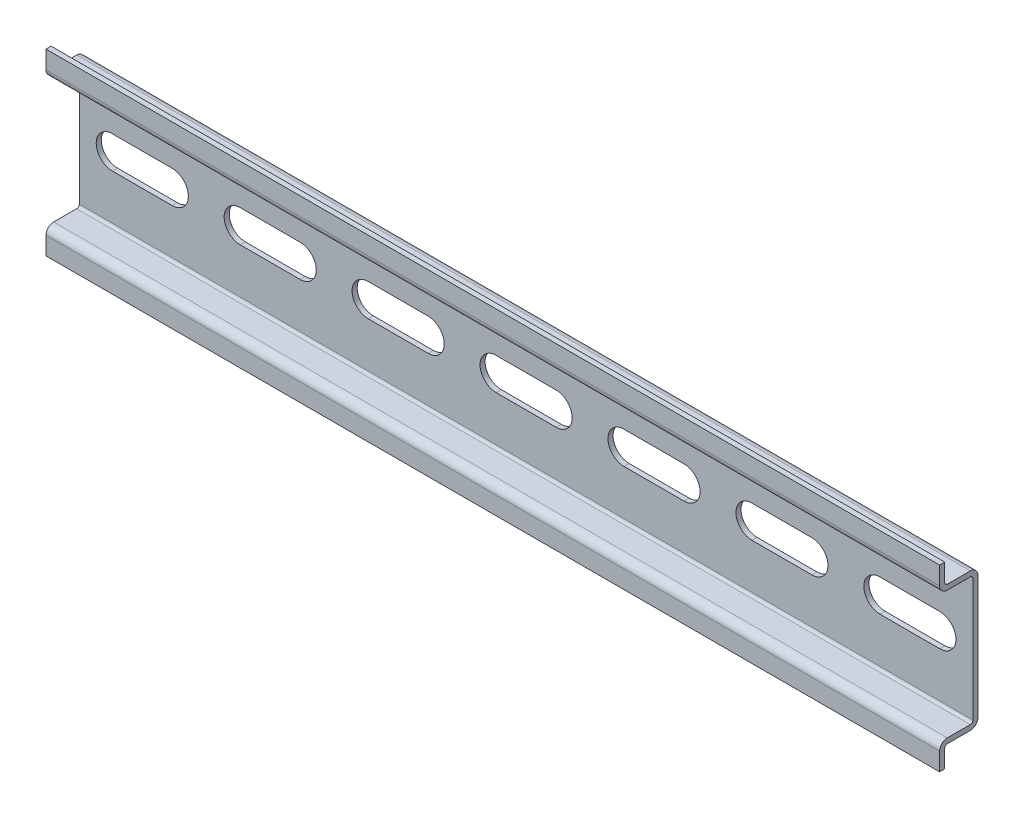
from build123d import *

# Parameters (mm, degrees)
EXTRUDE_THIN1_DEPTH      = 87.3125
EXTRUDE_THIN1_DEPTH_BACK = 87.3125
CUT_EXTRUDE1_DEPTH       = 90.127914574
LPATTERN1_COUNT          = 4
LPATTERN1_PITCH          = 25
LPATTERN1_COL_COUNT      = 4
LPATTERN1_COL_PITCH      = 25


with BuildPart() as part:
    # Sketch3 → Extrude-Thin1 (new, two sides: drawn at the far end of the back side and taken through both)
    with BuildSketch(Plane(origin=(0, 0, 0), x_dir=(0, 0, -1), z_dir=(1, 0, 0)).offset(-EXTRUDE_THIN1_DEPTH_BACK)):
        with BuildLine():
            Line((-2.75, -17.5), (-2.75, -14))
            ThreePointArc((-2.75, -14), (-2.603553391, -13.646446609), (-2.25, -13.5))
            Line((-2.25, -13.5), (2.25, -13.5))
            ThreePointArc((2.25, -13.5), (3.310660172, -13.060660172), (3.75, -12))
            Line((3.75, -12), (3.75, 12))
            ThreePointArc((3.75, 12), (3.310660172, 13.060660172), (2.25, 13.5))
            Line((2.25, 13.5), (-2.25, 13.5))
            ThreePointArc((-2.25, 13.5), (-2.603553391, 13.646446609), (-2.75, 14))
            Line((-2.75, 14), (-2.75, 17.5))
            Line((-2.75, 17.5), (-3.75, 17.5))
            Line((-3.75, 17.5), (-3.75, 14))
            ThreePointArc((-3.75, 14), (-3.310660172, 12.939339828), (-2.25, 12.5))
            Line((-2.25, 12.5), (2.25, 12.5))
            ThreePointArc((2.25, 12.5), (2.603553391, 12.353553391), (2.75, 12))
            Line((2.75, 12), (2.75, -12))
            ThreePointArc((2.75, -12), (2.603553391, -12.353553391), (2.25, -12.5))
            Line((2.25, -12.5), (-2.25, -12.5))
            ThreePointArc((-2.25, -12.5), (-3.310660172, -12.939339828), (-3.75, -14))
            Line((-3.75, -14), (-3.75, -17.5))
            Line((-3.75, -17.5), (-2.75, -17.5))
        make_face()
    extrude(amount=EXTRUDE_THIN1_DEPTH + EXTRUDE_THIN1_DEPTH_BACK)

    # Sketch4 → Cut-Extrude1 (cut, through all)
    with BuildSketch(Plane.XY):
        with BuildLine():
            Line((-5.85, -3.15), (5.85, -3.15))
            ThreePointArc((5.85, -3.15), (9, 0), (5.85, 3.15))
            Line((5.85, 3.15), (-5.85, 3.15))
            ThreePointArc((-5.85, 3.15), (-9, 0), (-5.85, -3.15))
        make_face()
    cut_extrude1 = extrude(amount=-CUT_EXTRUDE1_DEPTH, mode=Mode.SUBTRACT)

    # LPattern1: Cut-Extrude1 ×4
    with Locations(*[(i * LPATTERN1_PITCH, 0, 0) for i in range(1, LPATTERN1_COUNT)]):
        add(cut_extrude1, mode=Mode.SUBTRACT)

    # LPattern1 col: Cut-Extrude1 ×4
    with Locations(*[(-i * LPATTERN1_COL_PITCH, 0, 0) for i in range(1, LPATTERN1_COL_COUNT)]):
        add(cut_extrude1, mode=Mode.SUBTRACT)


solid = part.part
